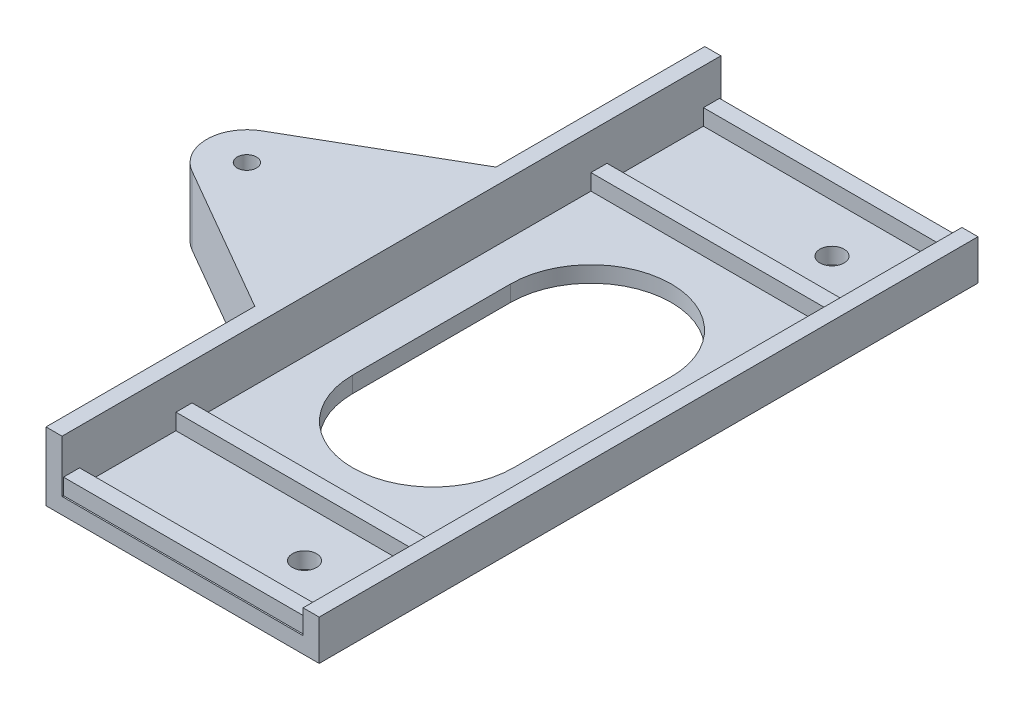
from build123d import *

# Parameters (mm, degrees)
EXTRU_MINCE1_DEPTH      = 41
ESQUISSE2_R             = 1.5
ENL_V_MAT_EXTRU_1_DEPTH = 53.414215629
ESQUISSE3_W             = 30
ESQUISSE3_H             = 2
BOSS_EXTRU_1_DEPTH      = 2
ENL_V_MAT_EXTRU_2_DEPTH = 53.414215629
ESQUISSE5_R             = 1.2
BOSS_EXTRU_2_DEPTH      = 8.5


with BuildPart() as part:
    # Esquisse1 → Extru.-Mince1 (new, symmetric)
    with BuildSketch(Plane.XY):
        Polygon((0, 3), (0, 0), (-30, 0), (-30, 6.5), (-32, 6.5), (-32, -2), (2, -2), (2, 3), align=None)
    extrude(amount=EXTRU_MINCE1_DEPTH, both=True)

    # Esquisse2 → Enlèv. mat.-Extru.1 (cut, through all)
    with BuildSketch(Plane(origin=(0, 0, 0), x_dir=(1, 0, 0), z_dir=(0, 1, 0))):
        with Locations(Location((-8, -32.825, 0), (0, 0, 180))):
            Circle(ESQUISSE2_R)
        with Locations((-8, 32.825)):
            Circle(ESQUISSE2_R)
    extrude(amount=-ENL_V_MAT_EXTRU_1_DEPTH, mode=Mode.SUBTRACT)

    # Esquisse3 → Boss.-Extru.1 (add)
    with BuildSketch(Plane(origin=(0, 0, 0), x_dir=(1, 0, 0), z_dir=(0, 1, 0))):
        with Locations((-15, 25.825)):
            Rectangle(ESQUISSE3_W, ESQUISSE3_H)
        with Locations((-15, -25.825)):
            Rectangle(ESQUISSE3_W, ESQUISSE3_H)
        with Locations((-15, -39.825)):
            Rectangle(ESQUISSE3_W, ESQUISSE3_H)
        with Locations((-15, 39.825)):
            Rectangle(ESQUISSE3_W, ESQUISSE3_H)
    extrude(amount=BOSS_EXTRU_1_DEPTH)

    # Esquisse4 → Enlèv. mat.-Extru.2 (cut, through all)
    with BuildSketch(Plane(origin=(0, 0, 0), x_dir=(1, 0, 0), z_dir=(0, 1, 0))):
        with BuildLine():
            Line((-5, 9.825), (-5, -9.825))
            ThreePointArc((-5, -9.825), (-15, -19.825), (-25, -9.825))
            Line((-25, -9.825), (-25, 9.825))
            ThreePointArc((-25, 9.825), (-15, 19.825), (-5, 9.825))
        make_face()
    extrude(amount=-ENL_V_MAT_EXTRU_2_DEPTH, mode=Mode.SUBTRACT)

    # Esquisse5 → Boss.-Extru.2 (add)
    with BuildSketch(Plane(origin=(0, 6.5, 0), x_dir=(1, 0, 0), z_dir=(0, 1, 0))):
        with BuildLine():
            Line((-50.5, 4.330127019), (-32, 15.011106999))
            Line((-32, 15.011106999), (-32, -15.011106999))
            Line((-32, -15.011106999), (-50.5, -4.330127019))
            ThreePointArc((-50.5, -4.330127019), (-53, 0), (-50.5, 4.330127019))
        make_face()
        with Locations(Location((-48, 0, 0), (0, 0, 270))):
            Circle(ESQUISSE5_R, mode=Mode.SUBTRACT)
    extrude(amount=-BOSS_EXTRU_2_DEPTH)


solid = part.part
